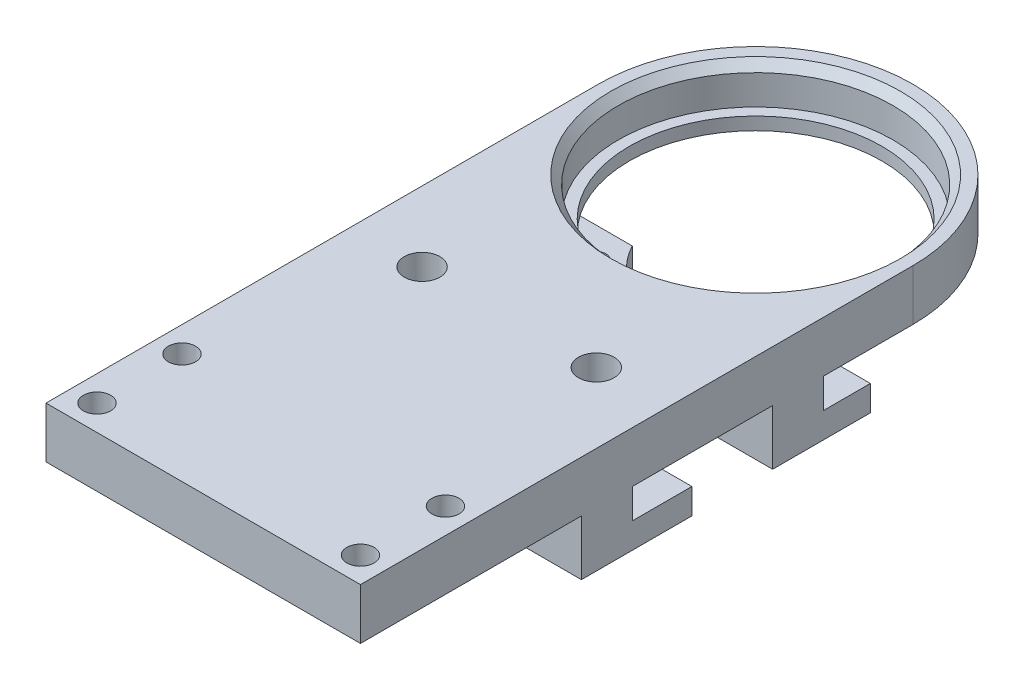
from build123d import *

# Parameters (mm, degrees)
EXTRUDE_1_DEPTH     = 6
SKETCH_2_R          = 16.15
CUT_EXTRUDE_1_DEPTH = 4.5
SKETCH_3_R          = 14.85
CUT_EXTRUDE_2_DEPTH = 68.731085921
CHAMFER_1_SIZE      = 1
CHAMFER_1_SIZE2     = 0.900404044
SKETCH_4_W          = 37
SKETCH_4_H          = 6
EXTRUDE_2_DEPTH     = 6.5
SKETCH_5_W          = 14.3
SKETCH_5_H          = 2.8
CUT_EXTRUDE_3_DEPTH = 1.5
SKETCH_6_W          = 11.35
SKETCH_6_H          = 3
EXTRUDE_3_DEPTH     = 28
SKETCH_7_R          = 1.15
CUT_EXTRUDE_4_DEPTH = 69.727723664
CUT_EXTRUDE_5_REACH = 70.728
SKETCH_8_R          = 2.1
CUT_EXTRUDE_START   = -3
SKETCH_9_R          = 10.75
SKETCH_9_W          = 37
SKETCH_9_H          = 9.5
CUT_EXTRUDE_6_DEPTH = 3
CUT_EXTRUDE_7_REACH = 70.728
SKETCH_10_R         = 1.6
CHAMFER_2_SIZE      = 1
CHAMFER_2_SIZE2     = 0.900404044


with BuildPart() as part:
    # 스케치1 → 보스-돌출1 (new body)
    with BuildSketch(Plane(origin=(0, 0, 0), x_dir=(1, 0, 0), z_dir=(0, 1, 0))):
        with BuildLine():
            Line((-18.5, 0), (-18.5, -65))
            Line((-18.5, -65), (18.5, -65))
            Line((18.5, -65), (18.5, 0))
            ThreePointArc((18.5, 0), (0, 18.5), (-18.5, 0))
        make_face()
    extrude(amount=EXTRUDE_1_DEPTH)

    # 스케치2 → 컷-돌출1 (cut)
    with BuildSketch(Plane(origin=(0, 6, 0), x_dir=(1, 0, 0), z_dir=(0, 1, 0))):
        with Locations(Location((0, 0, 0), (0, 0, 270))):
            Circle(SKETCH_2_R)
    extrude(amount=-CUT_EXTRUDE_1_DEPTH, mode=Mode.SUBTRACT)

    # 스케치3 → 컷-돌출2 (cut, through all)
    with BuildSketch(Plane(origin=(0, 1.5, 0), x_dir=(1, 0, 0), z_dir=(0, 1, 0))):
        with Locations(Location((0, 0, 0), (0, 0, 270))):
            Circle(SKETCH_3_R)
    extrude(amount=-CUT_EXTRUDE_2_DEPTH, mode=Mode.SUBTRACT)

    # 모따기1
    chamfer_1_edges = [part.edges().sort_by_distance(p)[0] for p in [
        (0, 6, -16.15),
    ]]
    chamfer_1_side = [part.faces().sort_by_distance(p)[0] for p in [
        (0, 3.75, -16.15),
    ]]
    chamfer(chamfer_1_edges, length=CHAMFER_1_SIZE, length2=CHAMFER_1_SIZE2, reference=chamfer_1_side[0])

    # 스케치4 → 보스-돌출2 (add)
    with BuildSketch(Plane.XZ):
        with Locations((0, 36)):
            Rectangle(SKETCH_4_W, SKETCH_4_H)
        with BuildLine():
            Line((-18.5, 16.5), (-10.5, 16.5))
            Line((-10.5, 16.5), (-10.5, 13.369741957))
            ThreePointArc((-10.5, 13.369741957), (-12.02081528, 12.02081528), (-13.369741957, 10.5))
            Line((-13.369741957, 10.5), (-18.5, 10.5))
            Line((-18.5, 10.5), (-18.5, 16.5))
        make_face()
        with BuildLine():
            Line((18.5, 16.5), (10.5, 16.5))
            Line((10.5, 16.5), (10.5, 13.369741957))
            ThreePointArc((10.5, 13.369741957), (12.02081528, 12.02081528), (13.369741957, 10.5))
            Line((13.369741957, 10.5), (18.5, 10.5))
            Line((18.5, 10.5), (18.5, 16.5))
        make_face()
    extrude(amount=EXTRUDE_2_DEPTH)

    # 스케치5 → 컷-돌출3 (cut)
    with BuildSketch(Plane.XZ.offset(6.5)):
        with Locations((0, 34.4)):
            Rectangle(SKETCH_5_W, SKETCH_5_H)
    extrude(amount=-CUT_EXTRUDE_3_DEPTH, mode=Mode.SUBTRACT)

    # 스케치6 → 보스-돌출3 (add)
    with BuildSketch(Plane(origin=(0, 0, 33), x_dir=(-1, 0, 0), z_dir=(0, 0, -1))):
        with Locations((-12.825, -5)):
            Rectangle(SKETCH_6_W, SKETCH_6_H)
        with Locations((12.825, -5)):
            Rectangle(SKETCH_6_W, SKETCH_6_H)
    extrude(amount=EXTRUDE_3_DEPTH)

    # 스케치7 → 컷-돌출4 (cut, through all)
    with BuildSketch(Plane.XZ.offset(6.5)):
        with Locations(Location((-10.25, 29, 0), (0, 0, 270))):
            Circle(SKETCH_7_R)
        with Locations(Location((10.25, 29, 0), (0, 0, 270))):
            Circle(SKETCH_7_R)
        with Locations(Location((-10.25, 8.5, 0), (0, 0, 270))):
            Circle(SKETCH_7_R)
        with Locations(Location((10.25, 8.5, 0), (0, 0, 270))):
            Circle(SKETCH_7_R)
    extrude(amount=-CUT_EXTRUDE_4_DEPTH, mode=Mode.SUBTRACT)

    # 스케치8 → 컷-돌출5 (cut, up to next)
    with BuildSketch(Plane(origin=(0, 6, 0), x_dir=(1, 0, 0), z_dir=(0, 1, 0)), mode=Mode.PRIVATE) as cut_extrude_5_sk1:
        with Locations(Location((-10.25, -29, 0), (0, 0, 270))):
            Circle(SKETCH_8_R)
    cut_extrude_5_tool1 = extrude(cut_extrude_5_sk1.sketch, amount=-CUT_EXTRUDE_5_REACH, mode=Mode.PRIVATE) & part.part
    # 스케치8 → 컷-돌출5 (cut, up to next)
    with BuildSketch(Plane(origin=(0, 6, 0), x_dir=(1, 0, 0), z_dir=(0, 1, 0)), mode=Mode.PRIVATE) as cut_extrude_5_sk2:
        with Locations(Location((10.25, -29, 0), (0, 0, 270))):
            Circle(SKETCH_8_R)
    cut_extrude_5_tool2 = extrude(cut_extrude_5_sk2.sketch, amount=-CUT_EXTRUDE_5_REACH, mode=Mode.PRIVATE) & part.part
    add(cut_extrude_5_tool1.solids().sort_by_distance((-10.25, 6, 29))[0], mode=Mode.SUBTRACT)
    add(cut_extrude_5_tool2.solids().sort_by_distance((10.25, 6, 29))[0], mode=Mode.SUBTRACT)

    # 스케치9 → 컷-돌출6 (cut)
    with BuildSketch(Plane.XZ.offset(6.5).offset(CUT_EXTRUDE_START)):
        Circle(SKETCH_9_R)
        with Locations((0, 21.25)):
            Rectangle(SKETCH_9_W, SKETCH_9_H)
    extrude(amount=CUT_EXTRUDE_6_DEPTH, mode=Mode.SUBTRACT)

    # 스케치10 → 컷-돌출7 (cut, up to next)
    with BuildSketch(Plane(origin=(0, 6, 0), x_dir=(1, 0, 0), z_dir=(0, 1, 0)), mode=Mode.PRIVATE) as cut_extrude_7_sk1:
        with Locations(Location((-15.5, -52, 0), (0, 0, 270))):
            Circle(SKETCH_10_R)
    cut_extrude_7_tool1 = extrude(cut_extrude_7_sk1.sketch, amount=-CUT_EXTRUDE_7_REACH, mode=Mode.PRIVATE) & part.part
    # 스케치10 → 컷-돌출7 (cut, up to next)
    with BuildSketch(Plane(origin=(0, 6, 0), x_dir=(1, 0, 0), z_dir=(0, 1, 0)), mode=Mode.PRIVATE) as cut_extrude_7_sk2:
        with Locations(Location((15.5, -52, 0), (0, 0, 270))):
            Circle(SKETCH_10_R)
    cut_extrude_7_tool2 = extrude(cut_extrude_7_sk2.sketch, amount=-CUT_EXTRUDE_7_REACH, mode=Mode.PRIVATE) & part.part
    # 스케치10 → 컷-돌출7 (cut, up to next)
    with BuildSketch(Plane(origin=(0, 6, 0), x_dir=(1, 0, 0), z_dir=(0, 1, 0)), mode=Mode.PRIVATE) as cut_extrude_7_sk3:
        with Locations(Location((15.5, -62, 0), (0, 0, 270))):
            Circle(SKETCH_10_R)
    cut_extrude_7_tool3 = extrude(cut_extrude_7_sk3.sketch, amount=-CUT_EXTRUDE_7_REACH, mode=Mode.PRIVATE) & part.part
    # 스케치10 → 컷-돌출7 (cut, up to next)
    with BuildSketch(Plane(origin=(0, 6, 0), x_dir=(1, 0, 0), z_dir=(0, 1, 0)), mode=Mode.PRIVATE) as cut_extrude_7_sk4:
        with Locations(Location((-15.5, -62, 0), (0, 0, 270))):
            Circle(SKETCH_10_R)
    cut_extrude_7_tool4 = extrude(cut_extrude_7_sk4.sketch, amount=-CUT_EXTRUDE_7_REACH, mode=Mode.PRIVATE) & part.part
    add(cut_extrude_7_tool1.solids().sort_by_distance((-15.5, 6, 52))[0], mode=Mode.SUBTRACT)
    add(cut_extrude_7_tool2.solids().sort_by_distance((15.5, 6, 52))[0], mode=Mode.SUBTRACT)
    add(cut_extrude_7_tool3.solids().sort_by_distance((15.5, 6, 62))[0], mode=Mode.SUBTRACT)
    add(cut_extrude_7_tool4.solids().sort_by_distance((-15.5, 6, 62))[0], mode=Mode.SUBTRACT)

    # 모따기2
    chamfer_2_edges = [part.edges().sort_by_distance(p)[0] for p in [
        (-15.5, 0, 60.4),
        (15.5, 0, 60.4),
        (15.5, 0, 50.4),
        (-15.5, 0, 50.4),
    ]]
    chamfer_2_side = [part.faces().sort_by_distance(p)[0] for p in [
        (0, 0, 51.827011897),
    ]]
    chamfer(chamfer_2_edges, length=CHAMFER_2_SIZE, length2=CHAMFER_2_SIZE2, reference=chamfer_2_side[0])


solid = part.part
